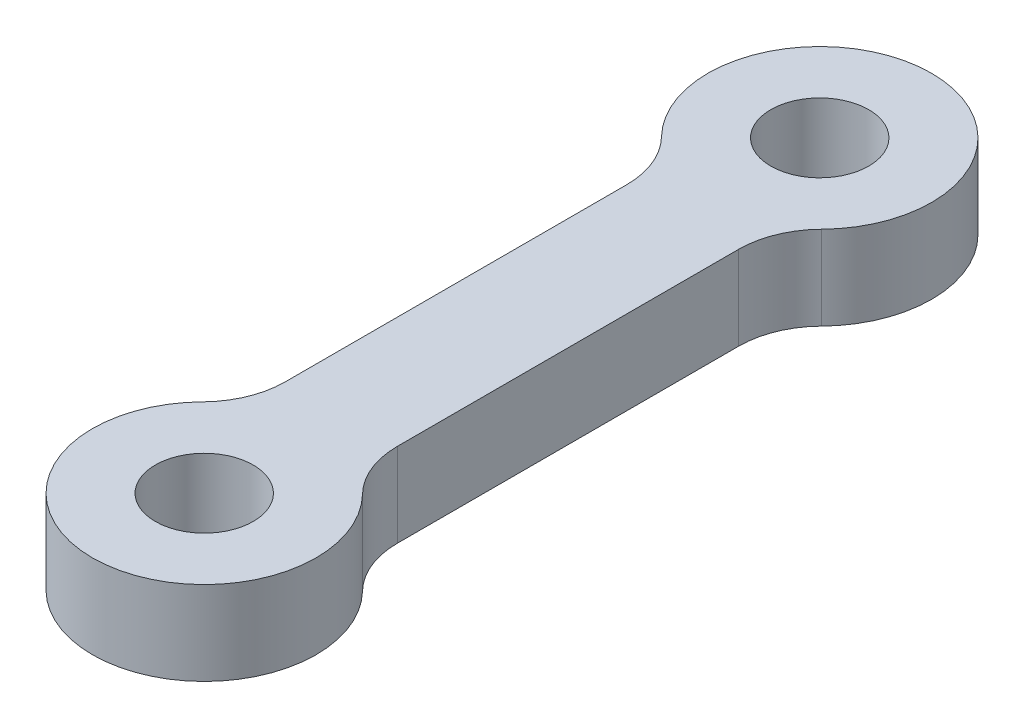
from build123d import *

# Parameters (mm, degrees)
SKETCH_1_R          = 4
EXTRUDE_1_DEPTH     = 3
EXTRUDE_1_2_DEPTH   = 3
SKETCH_2_W          = 4
SKETCH_2_H          = 22
EXTRUDE_2_DEPTH     = 3
FILLET_1_R          = 3
SKETCH_3_R          = 1.75
CUT_EXTRUDE_1_DEPTH = 3


with BuildPart() as part:
    # 스케치1 → 보스-돌출1 (new body)
    with BuildSketch(Plane(origin=(0, 0, 0), x_dir=(1, 0, 0), z_dir=(0, 1, 0))):
        with Locations(Location((0, 0, 0), (0, 0, 270))):
            Circle(SKETCH_1_R)
    extrude(amount=EXTRUDE_1_DEPTH)



with BuildPart() as body_2:
    # 스케치1 → Extrude 1 2 (new body)
    with BuildSketch(Plane(origin=(0, 0, 0), x_dir=(1, 0, 0), z_dir=(0, 1, 0))):
        with Locations(Location((0, 22, 0), (0, 0, 270))):
            Circle(SKETCH_1_R)
    extrude(amount=EXTRUDE_1_2_DEPTH)


with BuildPart() as part_1:
    add(part.part)

    add(body_2.part)  # 보스-돌출2 merges body 2
    # 스케치2 → 보스-돌출2 (add)
    with BuildSketch(Plane(origin=(0, 3, 0), x_dir=(1, 0, 0), z_dir=(0, 1, 0))):
        with Locations((0, 11)):
            Rectangle(SKETCH_2_W, SKETCH_2_H)
    extrude(amount=-EXTRUDE_2_DEPTH)

    # 필렛1
    fillet_1_edges = [part_1.edges().sort_by_distance(p)[0] for p in [
        (2, 1.5, -3.464101615),
        (-2, 1.5, -3.464101615),
        (-2, 1.5, -18.535898385),
        (2, 1.5, -18.535898385),
    ]]
    fillet(fillet_1_edges, radius=FILLET_1_R)

    # 스케치3 → 컷-돌출1 (cut)
    with BuildSketch(Plane(origin=(0, 3, 0), x_dir=(1, 0, 0), z_dir=(0, 1, 0))):
        with Locations(Location((0, 22, 0), (0, 0, 270))):
            Circle(SKETCH_3_R)
        with Locations(Location((0, 0, 0), (0, 0, 270))):
            Circle(SKETCH_3_R)
    extrude(amount=-CUT_EXTRUDE_1_DEPTH, mode=Mode.SUBTRACT)


solid = part_1.part
